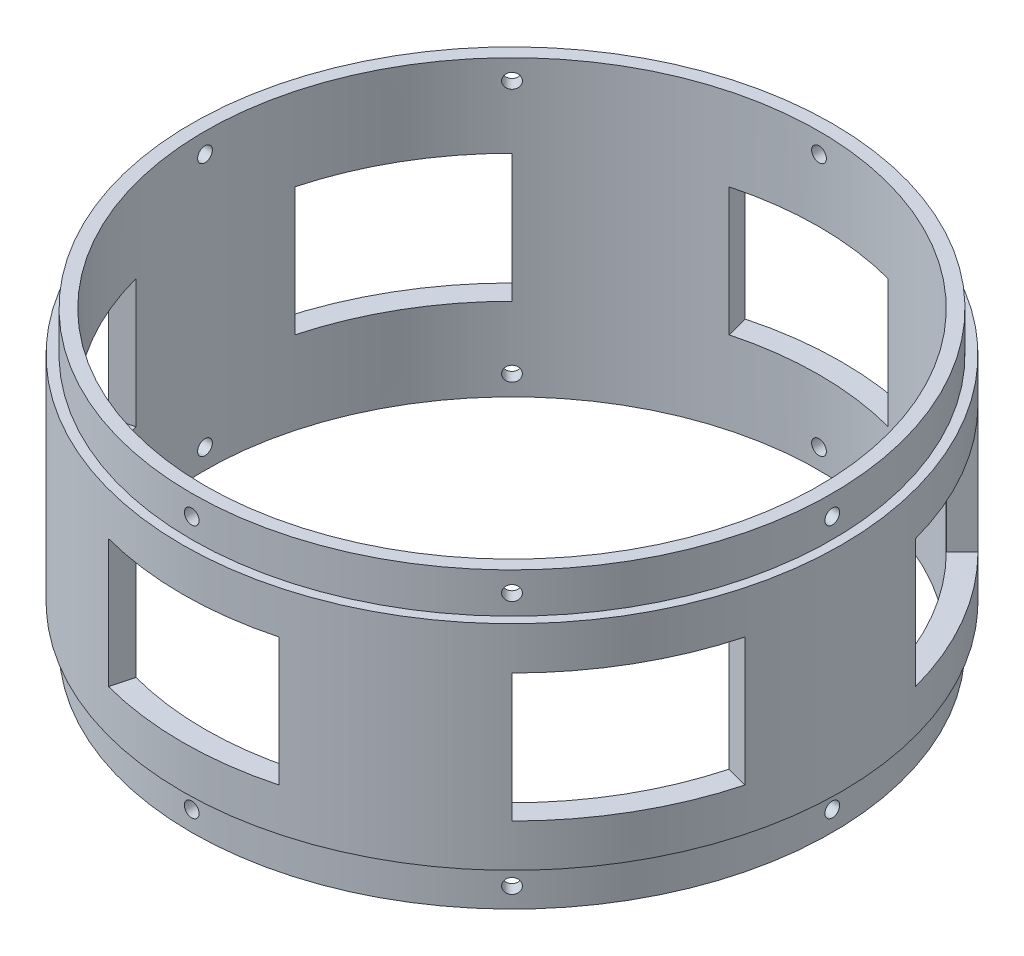
from build123d import *
from build123d.topology import SkipClean

# Parameters (mm, degrees)
SKETCH1_R               = 78.359
SKETCH1_R_2             = 73.025
BOSS_EXTRUDE1_DEPTH     = 50.8
BOSS_EXTRUDE2_START     = 50.8
BOSS_EXTRUDE2_DEPTH     = 9.525
BOSS_EXTRUDE3_START     = -9.525
SKETCH1_4_R             = 76.1746
SKETCH1_4_R_2           = 73.025
BOSS_EXTRUDE3_DEPTH     = 9.525
CUT_EXTRUDE2_REACH      = 185.466
CUT_EXTRUDE2_END_RADIUS = 73.025
CUT_EXTRUDE3_START      = 10.16
CUT_EXTRUDE3_DEPTH      = 30.48
CIRPATTERN2_COUNT       = 6
CIRPATTERN3_COUNT       = 8


with BuildPart() as part:
    # Sketch1 → Boss-Extrude1 (new body)
    with BuildSketch(Plane(origin=(0, 0, 0), x_dir=(1, 0, 0), z_dir=(0, 1, 0))):
        with Locations(Location((0, 0, 0), (0, 0, 270))):
            Circle(SKETCH1_R)
        with Locations(Location((0, 0, 0), (0, 0, 270))):
            Circle(SKETCH1_R_2, mode=Mode.SUBTRACT)
    extrude(amount=BOSS_EXTRUDE1_DEPTH)

    # Sketch1<3> → Boss-Extrude2 (add)
    with BuildSketch(Plane(origin=(0, 0, 0), x_dir=(1, 0, 0), z_dir=(0, 1, 0)).offset(BOSS_EXTRUDE2_START)):
        with BuildLine():
            ThreePointArc((73.025, 0), (-44.454803353, -57.934627675), (-18.900260769, 70.536733465))
            Line((-18.900260769, 70.536733465), (-19.715437233, 73.579013447))
            ThreePointArc((-19.715437233, 73.579013447), (-46.37215835, -60.433373355), (76.1746, 0))
            ThreePointArc((76.1746, 0), (60.433373355, 46.37215835), (19.715437233, 73.579013447))
            Line((19.715437233, 73.579013447), (18.900260769, 70.536733465))
            ThreePointArc((18.900260769, 70.536733465), (57.934627675, 44.454803353), (73.025, 0))
        make_face()
        with BuildLine():
            Line((-19.715437233, 73.579013447), (-18.900260769, 70.536733465))
            ThreePointArc((-18.900260769, 70.536733465), (0, 73.025), (18.900260769, 70.536733465))
            Line((18.900260769, 70.536733465), (19.715437233, 73.579013447))
            ThreePointArc((19.715437233, 73.579013447), (0, 76.1746), (-19.715437233, 73.579013447))
        make_face()
    extrude(amount=BOSS_EXTRUDE2_DEPTH)

    # Sketch1<4> → Boss-Extrude3 (add)
    with BuildSketch(Plane(origin=(0, 0, 0), x_dir=(1, 0, 0), z_dir=(0, 1, 0)).offset(BOSS_EXTRUDE3_START)):
        with Locations(Location((0, 0, 0), (0, 0, 90))):
            Circle(SKETCH1_4_R)
        with Locations(Location((0, 0, 0), (0, 0, 270))):
            Circle(SKETCH1_4_R_2, mode=Mode.SUBTRACT)
    extrude(amount=BOSS_EXTRUDE3_DEPTH)

    # Cut-Extrude2: up to this cylinder (the profile starts outside it)
    with SkipClean():  # the faces are left unmerged after this step: merging them gives an invalid solid
        cut_extrude2_end = Plane(origin=(0, 25.4, 0), z_dir=(0, -1, 0)) * Cylinder(CUT_EXTRUDE2_END_RADIUS, 578.307, mode=Mode.PRIVATE)
        # Sketch3 → Cut-Extrude2 (cut, up to the surface)
        with BuildSketch(Plane(origin=(0, 0, -76.1746), x_dir=(-1, 0, 0), z_dir=(0, 0, -1)), mode=Mode.PRIVATE) as cut_extrude2_sk1:
            with BuildLine():
                ThreePointArc((1.75, 55.5625), (1.237436867, 56.799936867), (0, 57.3125))
                Line((0, 57.3125), (0, 53.8125))
                ThreePointArc((0, 53.8125), (1.237436867, 54.325063133), (1.75, 55.5625))
            make_face()
        cut_extrude2_tool1 = extrude(cut_extrude2_sk1.sketch, amount=-CUT_EXTRUDE2_REACH, mode=Mode.PRIVATE) - cut_extrude2_end
        # Sketch3 → Cut-Extrude2 (cut, up to the surface)
        with BuildSketch(Plane(origin=(0, 0, -76.1746), x_dir=(-1, 0, 0), z_dir=(0, 0, -1)), mode=Mode.PRIVATE) as cut_extrude2_sk2:
            with BuildLine():
                Line((0, 53.8125), (0, 57.3125))
                ThreePointArc((0, 57.3125), (-1.75, 55.5625), (0, 53.8125))
            make_face()
        cut_extrude2_tool2 = extrude(cut_extrude2_sk2.sketch, amount=-CUT_EXTRUDE2_REACH, mode=Mode.PRIVATE) - cut_extrude2_end
        # Sketch3 → Cut-Extrude2 (cut, up to the surface)
        with BuildSketch(Plane(origin=(0, 0, -76.1746), x_dir=(-1, 0, 0), z_dir=(0, 0, -1)), mode=Mode.PRIVATE) as cut_extrude2_sk3:
            with BuildLine():
                ThreePointArc((1.75, 55.5625), (1.237436867, 56.799936867), (0, 57.3125))
                Line((0, 57.3125), (0, 53.8125))
                ThreePointArc((0, 53.8125), (1.237436867, 54.325063133), (1.75, 55.5625))
            make_face()
        cut_extrude2_tool3 = extrude(cut_extrude2_sk3.sketch, amount=-CUT_EXTRUDE2_REACH, mode=Mode.PRIVATE) - cut_extrude2_end
        # Sketch3 → Cut-Extrude2 (cut, up to the surface)
        with BuildSketch(Plane(origin=(0, 0, -76.1746), x_dir=(-1, 0, 0), z_dir=(0, 0, -1)), mode=Mode.PRIVATE) as cut_extrude2_sk4:
            with BuildLine():
                Line((0, 53.8125), (0, 57.3125))
                ThreePointArc((0, 57.3125), (-1.75, 55.5625), (0, 53.8125))
            make_face()
        cut_extrude2_tool4 = extrude(cut_extrude2_sk4.sketch, amount=-CUT_EXTRUDE2_REACH, mode=Mode.PRIVATE) - cut_extrude2_end
        # Sketch3 → Cut-Extrude2 (cut, up to the surface)
        with BuildSketch(Plane(origin=(0, 0, -76.1746), x_dir=(-1, 0, 0), z_dir=(0, 0, -1)), mode=Mode.PRIVATE) as cut_extrude2_sk5:
            with BuildLine():
                ThreePointArc((1.75, -4.7625), (1.237436867, -3.525063133), (0, -3.0125))
                Line((0, -3.0125), (0, -6.5125))
                ThreePointArc((0, -6.5125), (1.237436867, -5.999936867), (1.75, -4.7625))
            make_face()
        cut_extrude2_tool5 = extrude(cut_extrude2_sk5.sketch, amount=-CUT_EXTRUDE2_REACH, mode=Mode.PRIVATE) - cut_extrude2_end
        # Sketch3 → Cut-Extrude2 (cut, up to the surface)
        with BuildSketch(Plane(origin=(0, 0, -76.1746), x_dir=(-1, 0, 0), z_dir=(0, 0, -1)), mode=Mode.PRIVATE) as cut_extrude2_sk6:
            with BuildLine():
                Line((0, -6.5125), (0, -3.0125))
                ThreePointArc((0, -3.0125), (-1.75, -4.7625), (0, -6.5125))
            make_face()
        cut_extrude2_tool6 = extrude(cut_extrude2_sk6.sketch, amount=-CUT_EXTRUDE2_REACH, mode=Mode.PRIVATE) - cut_extrude2_end
        # Sketch3 → Cut-Extrude2 (cut, up to the surface)
        with BuildSketch(Plane(origin=(0, 0, -76.1746), x_dir=(-1, 0, 0), z_dir=(0, 0, -1)), mode=Mode.PRIVATE) as cut_extrude2_sk7:
            with BuildLine():
                ThreePointArc((1.75, -4.7625), (1.237436867, -3.525063133), (0, -3.0125))
                Line((0, -3.0125), (0, -6.5125))
                ThreePointArc((0, -6.5125), (1.237436867, -5.999936867), (1.75, -4.7625))
            make_face()
        cut_extrude2_tool7 = extrude(cut_extrude2_sk7.sketch, amount=-CUT_EXTRUDE2_REACH, mode=Mode.PRIVATE) - cut_extrude2_end
        # Sketch3 → Cut-Extrude2 (cut, up to the surface)
        with BuildSketch(Plane(origin=(0, 0, -76.1746), x_dir=(-1, 0, 0), z_dir=(0, 0, -1)), mode=Mode.PRIVATE) as cut_extrude2_sk8:
            with BuildLine():
                Line((0, -6.5125), (0, -3.0125))
                ThreePointArc((0, -3.0125), (-1.75, -4.7625), (0, -6.5125))
            make_face()
        cut_extrude2_tool8 = extrude(cut_extrude2_sk8.sketch, amount=-CUT_EXTRUDE2_REACH, mode=Mode.PRIVATE) - cut_extrude2_end
        cut_extrude2 = cut_extrude2_tool1.solids().sort_by_distance((-0.742723, 55.5625, -76.1746))[0] + cut_extrude2_tool2.solids().sort_by_distance((0.742723, 55.5625, -76.1746))[0] + cut_extrude2_tool3.solids().sort_by_distance((-0.742723, 55.5625, -76.1746))[0] + cut_extrude2_tool4.solids().sort_by_distance((0.742723, 55.5625, -76.1746))[0] + cut_extrude2_tool5.solids().sort_by_distance((-0.742723, -4.7625, -76.1746))[0] + cut_extrude2_tool6.solids().sort_by_distance((0.742723, -4.7625, -76.1746))[0] + cut_extrude2_tool7.solids().sort_by_distance((-0.742723, -4.7625, -76.1746))[0] + cut_extrude2_tool8.solids().sort_by_distance((0.742723, -4.7625, -76.1746))[0]
        add(cut_extrude2, mode=Mode.SUBTRACT)

    # Sketch1<7> → Cut-Extrude3 (cut)
    with SkipClean():  # the faces are left unmerged after this step: merging them gives an invalid solid
        with BuildSketch(Plane(origin=(0, 0, 0), x_dir=(1, 0, 0), z_dir=(0, 1, 0)).offset(CUT_EXTRUDE3_START)):
            with BuildLine():
                ThreePointArc((-18.900260769, 70.536733465), (0, 73.025), (18.900260769, 70.536733465))
                Line((18.900260769, 70.536733465), (20.280801555, 75.688981822))
                ThreePointArc((20.280801555, 75.688981822), (0, 78.359), (-20.280801555, 75.688981822))
                Line((-20.280801555, 75.688981822), (-18.900260769, 70.536733465))
            make_face()
        cut_extrude3 = extrude(amount=CUT_EXTRUDE3_DEPTH, mode=Mode.SUBTRACT)

    # CirPattern2: Cut-Extrude3 ×6 about axis
    with SkipClean():  # the faces are left unmerged after this step: merging them gives an invalid solid
        cirpattern2_axis = Axis((0, 0, 0), (0, 1, 0))
        for i in range(1, CIRPATTERN2_COUNT):
            add(cut_extrude3.rotate(cirpattern2_axis, i * 360 / CIRPATTERN2_COUNT), mode=Mode.SUBTRACT)

    # CirPattern3: Cut-Extrude2 ×8 about axis
    with SkipClean():  # the faces are left unmerged after this step: merging them gives an invalid solid
        cirpattern3_axis = Axis((0, 0, 0), (0, 1, 0))
        for i in range(1, CIRPATTERN3_COUNT):
            add(cut_extrude2.rotate(cirpattern3_axis, i * 360 / CIRPATTERN3_COUNT), mode=Mode.SUBTRACT)


solid = part.part
